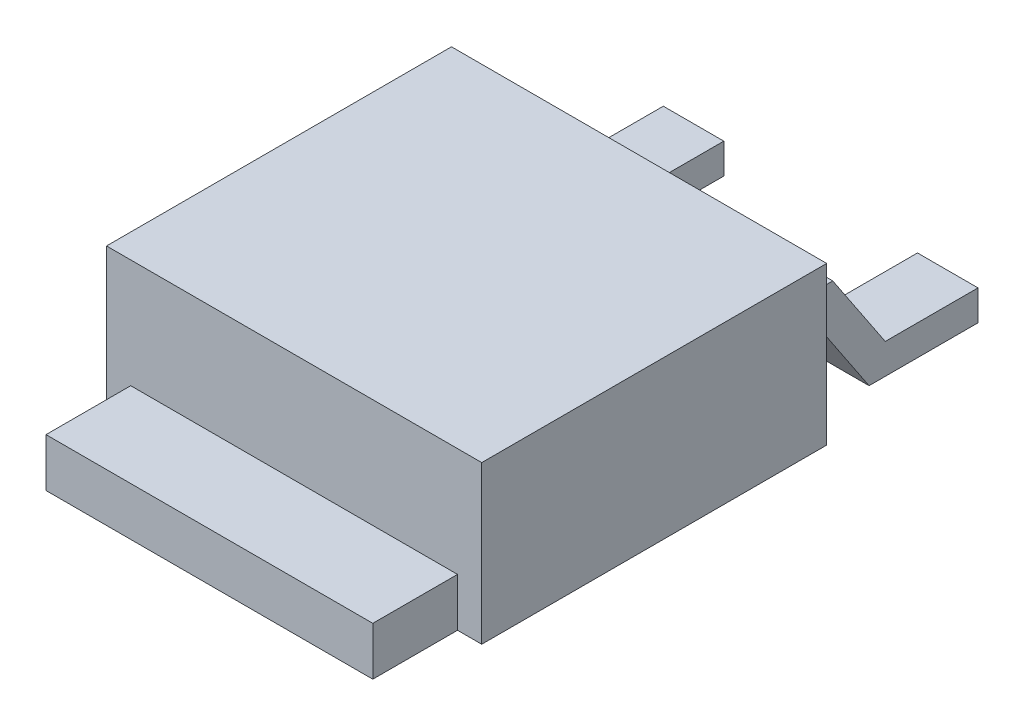
from build123d import *

# Parameters (mm, degrees)
CROQUIS1_W              = 5.7
CROQUIS1_H              = 2.6
SALIENTE_EXTRUIR1_DEPTH = 6.2
CROQUIS2_W              = 5.4
CROQUIS2_H              = 0.8
SALIENTE_EXTRUIR2_DEPTH = 1.4
SALIENTE_EXTRUIR3_DEPTH = 1
MATRIZL1_COUNT          = 2
MATRIZL1_PITCH          = 4.2


with BuildPart() as part:
    # Croquis1 → Saliente-Extruir1 (new body)
    with BuildSketch(Plane(origin=(0, 0, 0), x_dir=(0, 0, -1), z_dir=(1, 0, 0))):
        with Locations((2.85, 1.3)):
            Rectangle(CROQUIS1_W, CROQUIS1_H)
    extrude(amount=SALIENTE_EXTRUIR1_DEPTH)

    # Croquis2 → Saliente-Extruir2 (add)
    with BuildSketch(Plane.XY):
        with Locations((3.1, 0.4)):
            Rectangle(CROQUIS2_W, CROQUIS2_H)
    extrude(amount=SALIENTE_EXTRUIR2_DEPTH)

    # Croquis3 → Saliente-Extruir3 (add)
    with BuildSketch(Plane.ZY.offset(-0.5)):
        Polygon((-5.7, 1.8), (-6.3, 1.8), (-7.167456635, 0.5), (-8.7, 0.5), (-8.7, 0), (-6.9, 0), (-6.032543365, 1.3), (-5.7, 1.3), align=None)
    saliente_extruir3 = extrude(amount=-SALIENTE_EXTRUIR3_DEPTH)

    # MatrizL1: Saliente-Extruir3 ×2
    with Locations(*[(i * MATRIZL1_PITCH, 0, 0) for i in range(1, MATRIZL1_COUNT)]):
        add(saliente_extruir3)


solid = part.part
